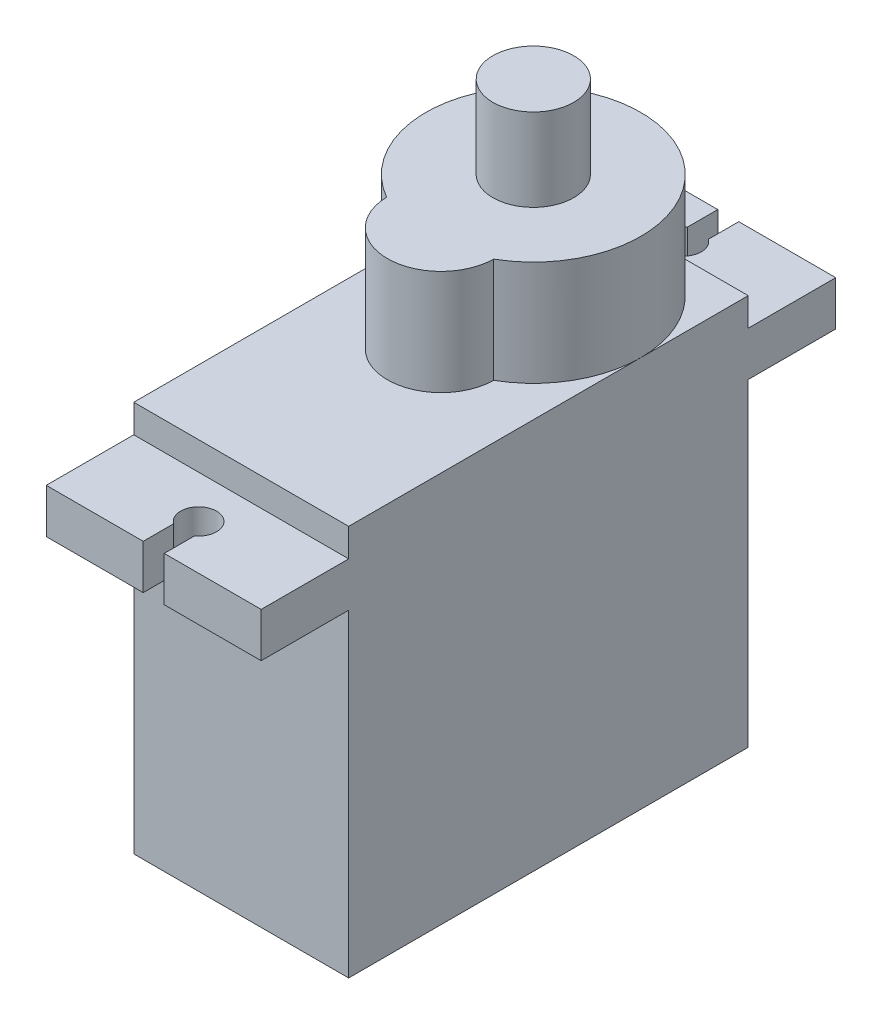
from build123d import *

# Parameters (mm, degrees)
SKETCH1_W           = 12.28
SKETCH1_H           = 22.83
BOSS_EXTRUDE1_DEPTH = 22.35
BOSS_EXTRUDE2_DEPTH = 2.54
BOSS_EXTRUDE3_DEPTH = 6
BOSS_EXTRUDE4_REACH = 39.427
SKETCH4_R           = 2.31


with BuildPart() as part:
    # Sketch1 → Boss-Extrude1 (new body)
    with BuildSketch(Plane(origin=(0, 0, 0), x_dir=(1, 0, 0), z_dir=(0, 1, 0))):
        Rectangle(SKETCH1_W, SKETCH1_H)
    extrude(amount=BOSS_EXTRUDE1_DEPTH)

    # Sketch2 → Boss-Extrude2 (add)
    with BuildSketch(Plane(origin=(0, 18.2, 0), x_dir=(-1, 0, 0), z_dir=(0, -1, 0))):
        with BuildLine():
            Line((6.14, 11.415), (6.14, 16.415))
            Line((6.14, 16.415), (0.6, 16.415))
            Line((0.6, 16.415), (0.6, 14.681038507))
            ThreePointArc((0.6, 14.681038507), (0, 12.825), (-0.6, 14.681038507))
            Line((-0.6, 14.681038507), (-0.6, 16.415))
            Line((-0.6, 16.415), (-6.14, 16.415))
            Line((-6.14, 16.415), (-6.14, 11.415))
            Line((-6.14, 11.415), (6.14, 11.415))
        make_face()
        with BuildLine():
            Line((6.14, -11.415), (6.14, -16.415))
            Line((6.14, -16.415), (0.6, -16.415))
            Line((0.6, -16.415), (0.6, -14.681038507))
            ThreePointArc((0.6, -14.681038507), (0, -12.825), (-0.6, -14.681038507))
            Line((-0.6, -14.681038507), (-0.6, -16.415))
            Line((-0.6, -16.415), (-6.14, -16.415))
            Line((-6.14, -16.415), (-6.14, -11.415))
            Line((-6.14, -11.415), (6.14, -11.415))
        make_face()
    extrude(amount=-BOSS_EXTRUDE2_DEPTH)

    # Sketch3 → Boss-Extrude3 (add)
    with BuildSketch(Plane(origin=(0, 22.35, 0), x_dir=(1, 0, 0), z_dir=(0, 1, 0))):
        with BuildLine():
            ThreePointArc((-3.059617572, -0.048376777), (0, -3.06), (3.059617572, -0.048376777))
            ThreePointArc((3.059617572, -0.048376777), (0, 11.415), (-3.059617572, -0.048376777))
        make_face()
    extrude(amount=BOSS_EXTRUDE3_DEPTH)


with BuildPart() as body_2:

    # Sketch4 → Boss-Extrude4 (new, up to next)
    with BuildSketch(Plane(origin=(0, 33.07, 0), x_dir=(1, 0, 0), z_dir=(0, 1, 0)), mode=Mode.PRIVATE) as boss_extrude4_sk1:
        with Locations(Location((0, 5.275, 0), (0, 0, 270))):
            Circle(SKETCH4_R)
    boss_extrude4_tool1 = extrude(boss_extrude4_sk1.sketch, amount=-BOSS_EXTRUDE4_REACH, mode=Mode.PRIVATE) - part.part
    add(boss_extrude4_tool1.solids().sort_by_distance((0, 33.07, -5.275))[0])


solid = Compound([part.part, body_2.part])
